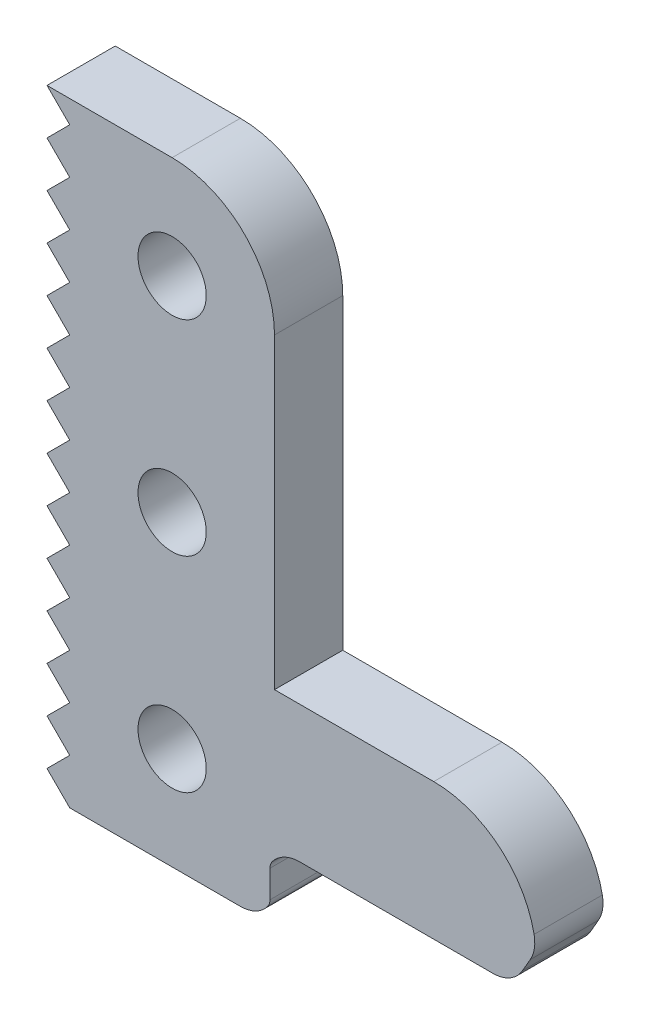
from build123d import *

# Parameters (mm, degrees)
MODEL_R                 = 1.5
SALIENTE_EXTRUIR1_DEPTH = 3


with BuildPart() as part:
    # Model → Saliente-Extruir1 (new body)
    with BuildSketch(Plane.XY):
        with BuildLine():
            Line((10.417346401, 265.129037091), (11.417346401, 266.129037091))
            Line((11.417346401, 266.129037091), (10.417346401, 267.129037091))
            Line((10.417346401, 267.129037091), (11.417346401, 268.129037091))
            Line((11.417346401, 268.129037091), (10.417346401, 269.129037091))
            Line((10.417346401, 269.129037091), (11.417346401, 270.129037091))
            Line((11.417346401, 270.129037091), (10.417346401, 271.129037091))
            Line((10.417346401, 271.129037091), (11.417346401, 272.129037091))
            Line((11.417346401, 272.129037091), (10.417346401, 273.129037091))
            Line((10.417346401, 273.129037091), (11.417346401, 274.129037091))
            Line((11.417346401, 274.129037091), (10.417346401, 275.129037091))
            Line((10.417346401, 275.129037091), (11.417346401, 276.129037091))
            Line((11.417346401, 276.129037091), (10.417346401, 277.129037091))
            Line((10.417346401, 277.129037091), (11.417346401, 278.129037091))
            Line((11.417346401, 278.129037091), (10.417346401, 279.129037091))
            Line((10.417346401, 279.129037091), (11.417346401, 280.129037091))
            Line((11.417346401, 280.129037091), (10.417346401, 281.129037091))
            Line((10.417346401, 281.129037091), (11.417346401, 282.129037091))
            Line((11.417346401, 282.129037091), (10.417346401, 283.129037091))
            Line((10.417346401, 283.129037091), (11.417346401, 284.129037091))
            Line((11.417346401, 284.129037091), (10.417346401, 285.129037091))
            Line((10.417346401, 285.129037091), (11.417346401, 286.129037091))
            Line((11.417346401, 286.129037091), (10.417346401, 287.129037091))
            Line((10.417346401, 287.129037091), (11.417346401, 288.129037091))
            Line((11.417346401, 288.129037091), (10.417346401, 289.129037091))
            Line((10.417346401, 289.129037091), (11.417346401, 290.129037091))
            Line((11.417346401, 290.129037091), (10.417346401, 291.129037091))
            Line((10.417346401, 291.129037091), (15.917346401, 291.129037091))
            ThreePointArc((15.917346401, 291.129037091), (19.099326917, 289.811017606), (20.417346401, 286.629037091))
            Line((20.417346401, 286.629037091), (20.417346401, 273.129037091))
            Line((20.417346401, 273.129037091), (27.417346401, 273.129037091))
            ThreePointArc((27.417346401, 273.129037091), (30.267267915, 272.111557351), (31.828417252, 269.51923592))
            ThreePointArc((31.828417252, 269.51923592), (31.838364225, 268.980221543), (31.657098407, 268.472502977))
            Line((31.657098407, 268.472502977), (31.314460718, 267.879037091))
            ThreePointArc((31.314460718, 267.879037091), (30.765422613, 267.329998985), (30.015422613, 267.129037091))
            Line((30.015422613, 267.129037091), (21.515422613, 267.129037091))
            ThreePointArc((21.515422613, 267.129037091), (20.845676718, 266.971214589), (20.316865454, 266.530957674))
            ThreePointArc((20.316865454, 266.530957674), (20.242169616, 266.388811129), (20.216384507, 266.23031748))
            Line((20.216384507, 266.23031748), (20.216384507, 265.027756703))
            ThreePointArc((20.216384507, 265.027756703), (20.190599398, 264.869263053), (20.11590356, 264.727116508))
            ThreePointArc((20.11590356, 264.727116508), (19.587092296, 264.286859593), (18.917346401, 264.129037091))
            Line((18.917346401, 264.129037091), (11.417346401, 264.129037091))
            Line((11.417346401, 264.129037091), (10.417346401, 265.129037091))
        make_face()
        with Locations((15.917346401, 268.629037091)):
            Circle(MODEL_R, mode=Mode.SUBTRACT)
        with Locations((15.917346401, 277.629037091)):
            Circle(MODEL_R, mode=Mode.SUBTRACT)
        with Locations((15.917346401, 286.629037091)):
            Circle(MODEL_R, mode=Mode.SUBTRACT)
    extrude(amount=SALIENTE_EXTRUIR1_DEPTH)


solid = part.part
